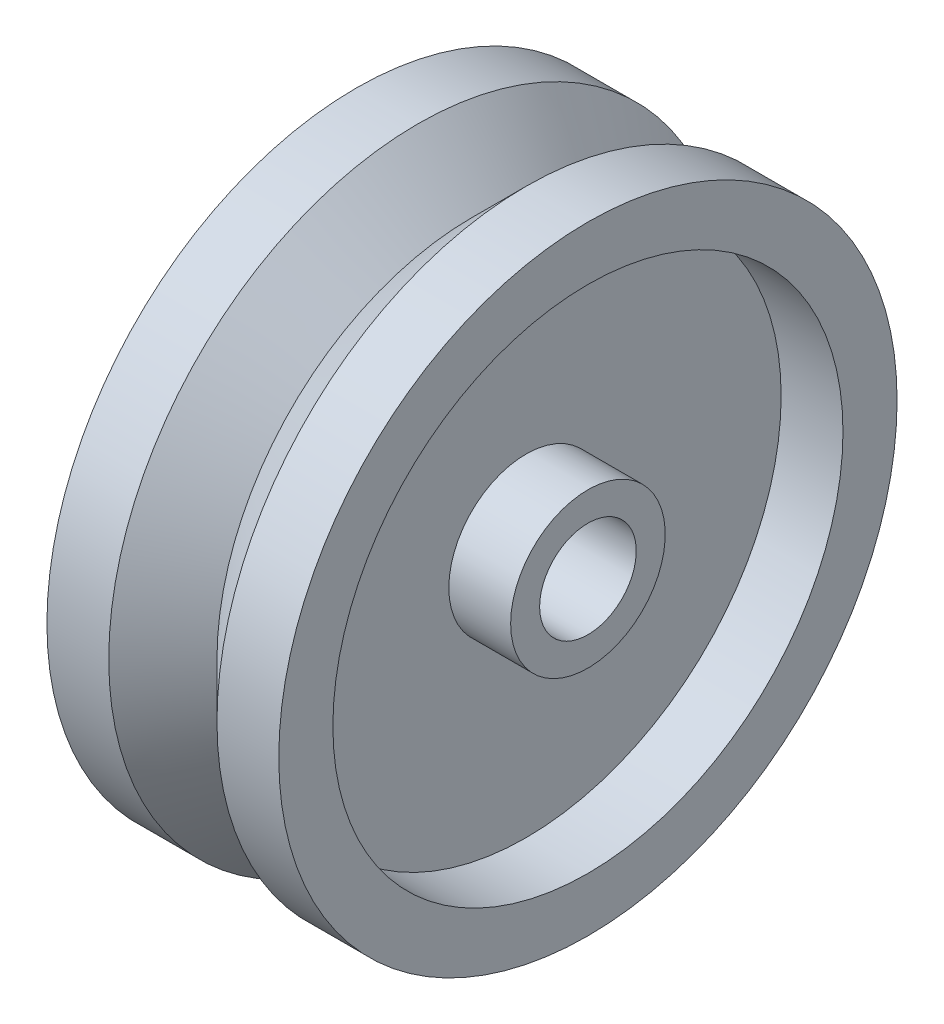
from build123d import *


with BuildPart() as part:
    # Sketch1 → Revolve1 (revolve)
    with BuildSketch(Plane.XY, mode=Mode.PRIVATE) as revolve1_sk:
        Polygon((-3.5, 20), (-7.5, 20), (-7.5, 16.5), (-3.5, 16.5), (-3.5, 5), (-7.5, 5), (-7.5, 3.125), (7.5, 3.125), (7.5, 5), (3.5, 5), (3.5, 16.5), (7.5, 16.5), (7.5, 20), (3.5, 20), (0, 16.5), align=None)
    revolve(revolve1_sk.sketch.rotate(Axis((-49.141791045, 0, 0), (1, 0, 0)), 90), axis=Axis((-49.141791045, 0, 0), (1, 0, 0)))


solid = part.part
